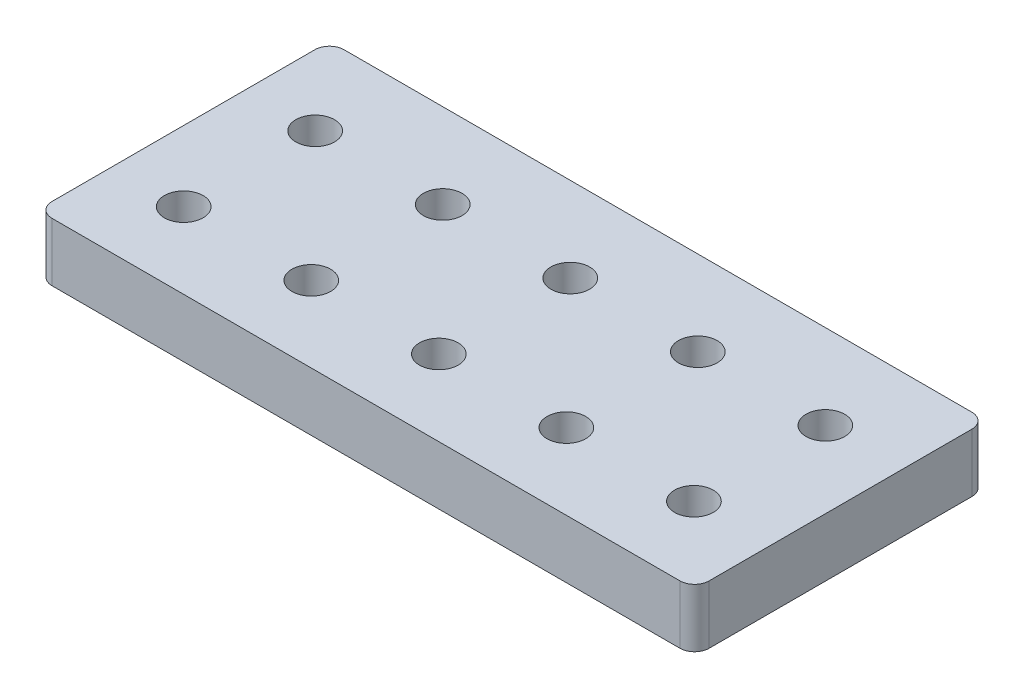
from build123d import *

# Parameters (mm, degrees)
BOSS_EXTRUDE1_DEPTH = 50.8
SKETCH2_R           = 50.8
CUT_EXTRUDE1_DEPTH  = 10.16
SKETCH3_R           = 11.43
CUT_EXTRUDE2_DEPTH  = 627.721516784
SKETCH7_R           = 16.8275
CUT_EXTRUDE3_DEPTH  = 35.56


with BuildPart() as part:
    # Sketch1 → Boss-Extrude1 (new body)
    with BuildSketch(Plane(origin=(0, 0, 0), x_dir=(1, 0, 0), z_dir=(0, 1, 0))):
        with BuildLine():
            Line((-12.7, 0), (-558.8, 0))
            ThreePointArc((-558.8, 0), (-567.780256121, 3.719743879), (-571.5, 12.7))
            Line((-571.5, 12.7), (-571.5, 241.3))
            ThreePointArc((-571.5, 241.3), (-567.780256121, 250.280256121), (-558.8, 254))
            Line((-558.8, 254), (-12.7, 254))
            ThreePointArc((-12.7, 254), (-3.719743879, 250.280256121), (0, 241.3))
            Line((0, 241.3), (0, 12.7))
            ThreePointArc((0, 12.7), (-3.719743879, 3.719743879), (-12.7, 0))
        make_face()
    extrude(amount=BOSS_EXTRUDE1_DEPTH)

    # Sketch2 → Cut-Extrude1 (cut)
    with BuildSketch(Plane(origin=(0, 0, 0), x_dir=(1, 0, 0), z_dir=(0, 1, 0))):
        with Locations(Location((-177.499611663, 66.04, 0), (0, 0, 270))):
            Circle(SKETCH2_R)
        with Locations(Location((-66.57081555, 66.04, 0), (0, 0, 270))):
            Circle(SKETCH2_R)
        with Locations(Location((-288.428407775, 66.04, 0), (0, 0, 270))):
            Circle(SKETCH2_R)
        with Locations(Location((-399.357203888, 66.04, 0), (0, 0, 270))):
            Circle(SKETCH2_R)
        with Locations(Location((-510.286, 66.04, 0), (0, 0, 270))):
            Circle(SKETCH2_R)
        with Locations(Location((-177.499611663, 180.34, 0), (0, 0, 270))):
            Circle(SKETCH2_R)
        with Locations(Location((-288.428407775, 180.34, 0), (0, 0, 270))):
            Circle(SKETCH2_R)
        with Locations(Location((-399.357203888, 180.34, 0), (0, 0, 270))):
            Circle(SKETCH2_R)
        with Locations(Location((-510.286, 180.34, 0), (0, 0, 270))):
            Circle(SKETCH2_R)
        with Locations(Location((-66.57081555, 180.34, 0), (0, 0, 270))):
            Circle(SKETCH2_R)
    extrude(amount=CUT_EXTRUDE1_DEPTH, mode=Mode.SUBTRACT)

    # Sketch3 → Cut-Extrude2 (cut, through all)
    with BuildSketch(Plane.XZ.offset(-10.16)):
        with Locations(Location((-66.57081555, -180.34, 0), (0, 0, 270))):
            Circle(SKETCH3_R)
        with Locations(Location((-177.499611663, -180.34, 0), (0, 0, 270))):
            Circle(SKETCH3_R)
        with Locations(Location((-288.428407775, -180.34, 0), (0, 0, 270))):
            Circle(SKETCH3_R)
        with Locations(Location((-399.357203888, -180.34, 0), (0, 0, 270))):
            Circle(SKETCH3_R)
        with Locations(Location((-510.286, -180.34, 0), (0, 0, 270))):
            Circle(SKETCH3_R)
        with Locations(Location((-510.286, -66.04, 0), (0, 0, 90))):
            Circle(SKETCH3_R)
        with Locations(Location((-399.357203888, -66.04, 0), (0, 0, 90))):
            Circle(SKETCH3_R)
        with Locations(Location((-288.428407775, -66.04, 0), (0, 0, 90))):
            Circle(SKETCH3_R)
        with Locations(Location((-177.499611663, -66.04, 0), (0, 0, 90))):
            Circle(SKETCH3_R)
        with Locations(Location((-66.57081555, -66.04, 0), (0, 0, 90))):
            Circle(SKETCH3_R)
    extrude(amount=-CUT_EXTRUDE2_DEPTH, mode=Mode.SUBTRACT)

    # Sketch7 → Cut-Extrude3 (cut)
    with BuildSketch(Plane(origin=(0, 50.8, 0), x_dir=(1, 0, 0), z_dir=(0, 1, 0))):
        with Locations(Location((-66.57081555, 180.34, 0), (0, 0, 270))):
            Circle(SKETCH7_R)
        with Locations(Location((-66.57081555, 66.04, 0), (0, 0, 270))):
            Circle(SKETCH7_R)
        with Locations(Location((-177.499611663, 66.04, 0), (0, 0, 270))):
            Circle(SKETCH7_R)
        with Locations(Location((-288.428407775, 66.04, 0), (0, 0, 270))):
            Circle(SKETCH7_R)
        with Locations(Location((-399.357203888, 66.04, 0), (0, 0, 270))):
            Circle(SKETCH7_R)
        with Locations(Location((-510.286, 66.04, 0), (0, 0, 270))):
            Circle(SKETCH7_R)
        with Locations(Location((-177.499611663, 180.34, 0), (0, 0, 270))):
            Circle(SKETCH7_R)
        with Locations(Location((-288.428407775, 180.34, 0), (0, 0, 270))):
            Circle(SKETCH7_R)
        with Locations(Location((-399.357203888, 180.34, 0), (0, 0, 270))):
            Circle(SKETCH7_R)
        with Locations(Location((-510.286, 180.34, 0), (0, 0, 270))):
            Circle(SKETCH7_R)
    extrude(amount=-CUT_EXTRUDE3_DEPTH, mode=Mode.SUBTRACT)


solid = part.part
